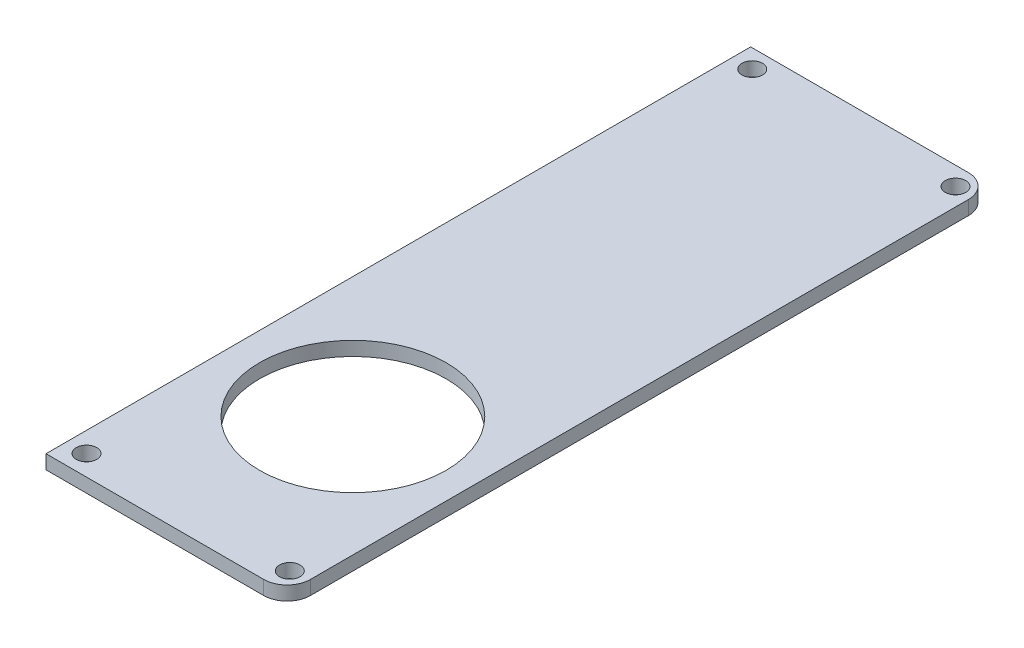
from build123d import *

# Parameters (mm, degrees)
SKETCH1_R           = 1.1
SKETCH1_R_2         = 10
BOSS_EXTRUDE2_DEPTH = 1.5


with BuildPart() as part:
    # Sketch1 → Boss-Extrude2 (new body)
    with BuildSketch(Plane(origin=(0, 0, 0), x_dir=(1, 0, 0), z_dir=(0, 1, 0))):
        with BuildLine():
            Line((-12.92, 37.765), (10.42, 37.765))
            ThreePointArc((10.42, 37.765), (12.187766953, 37.032766953), (12.92, 35.265))
            Line((12.92, 35.265), (12.92, -35.265))
            ThreePointArc((12.92, -35.265), (12.187766953, -37.032766953), (10.42, -37.765))
            Line((10.42, -37.765), (-12.92, -37.765))
            Line((-12.92, -37.765), (-12.92, 37.765))
        make_face()
        with Locations(Location((11.02, 35.785, 0), (0, 0, 270))):
            Circle(SKETCH1_R, mode=Mode.SUBTRACT)
        with Locations(Location((-10.77, 35.785, 0), (0, 0, 270))):
            Circle(SKETCH1_R, mode=Mode.SUBTRACT)
        with Locations(Location((-10.77, -35.575, 0), (0, 0, 270))):
            Circle(SKETCH1_R, mode=Mode.SUBTRACT)
        with Locations(Location((11.02, -35.575, 0), (0, 0, 270))):
            Circle(SKETCH1_R, mode=Mode.SUBTRACT)
        with Locations(Location((0.07, -17.865, 0), (0, 0, 270))):
            Circle(SKETCH1_R_2, mode=Mode.SUBTRACT)
    extrude(amount=BOSS_EXTRUDE2_DEPTH)


solid = part.part
